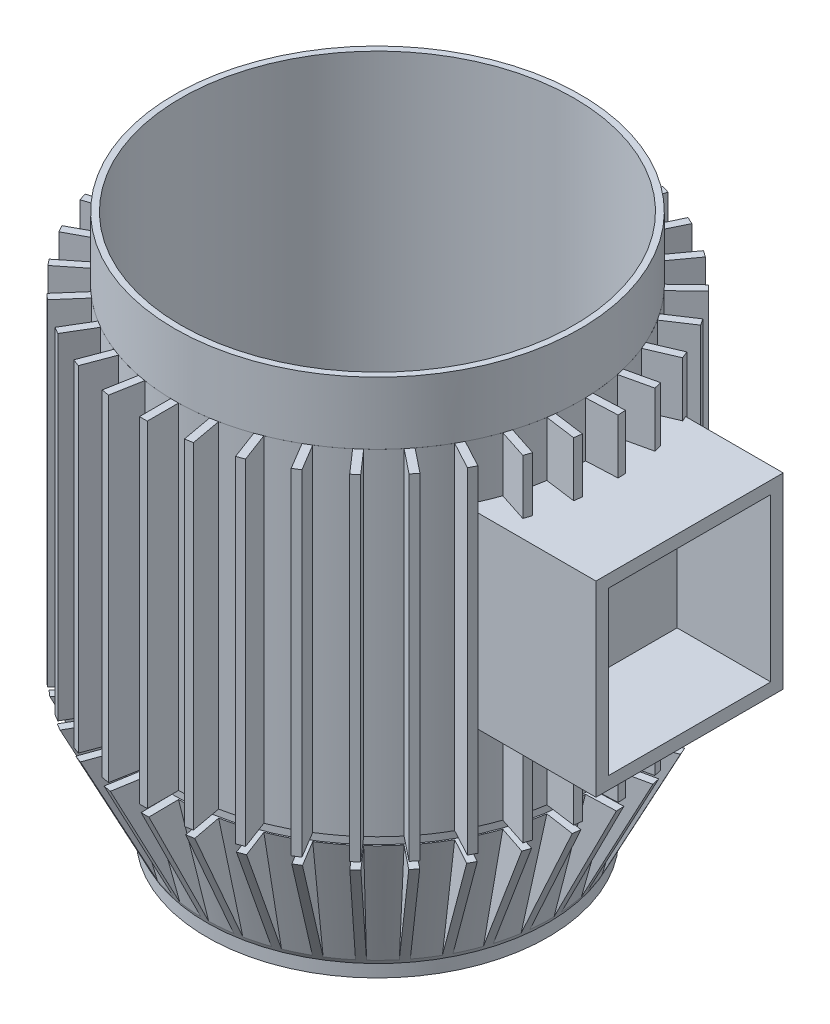
from build123d import *

# Parameters (mm, degrees)
SKETCH1_R           = 65
BOSS_EXTRUDE1_DEPTH = 170
CHAMFER1_SIZE       = 10
CHAMFER1_SIZE2      = 40
SHELL1_T            = -2
BOSS_EXTRUDE2_REACH = 231.619
SKETCH2_W           = 2.5
SKETCH2_H           = 170
CIRPATTERN1_COUNT   = 35
SKETCH4_R           = 10
CUT_EXTRUDE1_DEPTH  = 201.367373921
BOSS_EXTRUDE3_REACH = 257.232
SKETCH5_W           = 60
SKETCH5_H           = 60
SKETCH6_W           = 52
SKETCH6_H           = 52
CUT_EXTRUDE2_DEPTH  = 30
SKETCH7_W           = 15.566705205
SKETCH7_H           = 20
SKETCH_1_R          = 54.65595067
EXTRUDE_1_DEPTH     = 4


with BuildPart() as part:
    # Sketch1 → Boss-Extrude1 (new body)
    with BuildSketch(Plane(origin=(0, 0, 0), x_dir=(1, 0, 0), z_dir=(0, 1, 0))):
        with Locations(Location((0, 0, 0), (0, 0, 270))):
            Circle(SKETCH1_R)
    extrude(amount=-BOSS_EXTRUDE1_DEPTH)

    # Chamfer1
    chamfer1_edges = [part.edges().sort_by_distance(p)[0] for p in [
        (0, -170, -65),
    ]]
    chamfer1_side = [part.faces().sort_by_distance(p)[0] for p in [
        (0, -170, 0),
    ]]
    chamfer(chamfer1_edges, length=CHAMFER1_SIZE, length2=CHAMFER1_SIZE2, reference=chamfer1_side[0])

    # Shell1
    shell1_openings = [part.faces().sort_by_distance(p)[0] for p in [
        (0, 0, 0),
    ]]
    offset(amount=SHELL1_T, openings=shell1_openings, kind=Kind.INTERSECTION)

    # Sketch2 → Boss-Extrude2 (add, up to next)
    with BuildSketch(Plane.XY.offset(75), mode=Mode.PRIVATE) as boss_extrude2_sk1:
        with Locations((0, -85)):
            Rectangle(SKETCH2_W, SKETCH2_H)
    boss_extrude2_tool1 = extrude(boss_extrude2_sk1.sketch, amount=-BOSS_EXTRUDE2_REACH, mode=Mode.PRIVATE) - part.part
    boss_extrude2 = boss_extrude2_tool1.solids().sort_by_distance((0, -85, 75))[0]
    add(boss_extrude2)

    # CirPattern1: Boss-Extrude2 ×35 about axis
    cirpattern1_axis = Axis((0, 0, 0), (0, 1, 0))
    for i in range(1, CIRPATTERN1_COUNT):
        add(boss_extrude2.rotate(cirpattern1_axis, i * 360 / CIRPATTERN1_COUNT))

    # Sketch3 → Cut-Revolve1 (revolve, cut)
    with BuildSketch(Plane.XY, mode=Mode.PRIVATE) as cut_revolve1_sk:
        Polygon((54.65595067, -170), (74.489023715, -130.119386817), (64.567614542, -130), (64.567614542, -127.5), (90.450979811, -127.5), (90.450979811, -179.278387236), align=None)
    revolve(cut_revolve1_sk.sketch.rotate(Axis((0, 0, 0), (0, -1, 0)), 90), axis=Axis((0, 0, 0), (0, -1, 0)), mode=Mode.SUBTRACT)

    # Sketch4 → Cut-Extrude1 (cut, through all)
    with BuildSketch(Plane.XZ.offset(170)):
        with Locations(Location((0, 0, 0), (0, 0, 270))):
            Circle(SKETCH4_R)
    extrude(amount=-CUT_EXTRUDE1_DEPTH, mode=Mode.SUBTRACT)

    # Sketch5 → Boss-Extrude3 (add, up to next)
    with BuildSketch(Plane(origin=(100, 0, 0), x_dir=(0, 0, -1), z_dir=(1, 0, 0)), mode=Mode.PRIVATE) as boss_extrude3_sk1:
        with Locations((0, -67.5)):
            Rectangle(SKETCH5_W, SKETCH5_H)
    boss_extrude3_tool1 = extrude(boss_extrude3_sk1.sketch, amount=-BOSS_EXTRUDE3_REACH, mode=Mode.PRIVATE) - part.part
    add(boss_extrude3_tool1.solids().sort_by_distance((100, -67.5, 0))[0])

    # Sketch6 → Cut-Extrude2 (cut)
    with BuildSketch(Plane(origin=(100, 0, 0), x_dir=(0, 0, -1), z_dir=(1, 0, 0))):
        with Locations((0, -67.5)):
            Rectangle(SKETCH6_W, SKETCH6_H)
    extrude(amount=-CUT_EXTRUDE2_DEPTH, mode=Mode.SUBTRACT)

    # Sketch7 → Cut-Revolve2 (revolve, cut)
    with BuildSketch(Plane(origin=(0, 0, 0), x_dir=(0, 0, -1), z_dir=(1, 0, 0)), mode=Mode.PRIVATE) as cut_revolve2_sk:
        with Locations((-72.771332261, -10)):
            Rectangle(SKETCH7_W, SKETCH7_H)
    revolve(cut_revolve2_sk.sketch.rotate(Axis((0, 35.754785945, 0), (0, -1, 0)), 184.040925316), axis=Axis((0, 35.754785945, 0), (0, -1, 0)), mode=Mode.SUBTRACT)

    # 草图1 → 凸台-拉伸1 (add)
    with BuildSketch(Plane.XZ.offset(170)):
        with Locations(Location((0, 0, 0), (0, 0, 270))):
            Circle(SKETCH_1_R)
    extrude(amount=EXTRUDE_1_DEPTH)


solid = part.part
